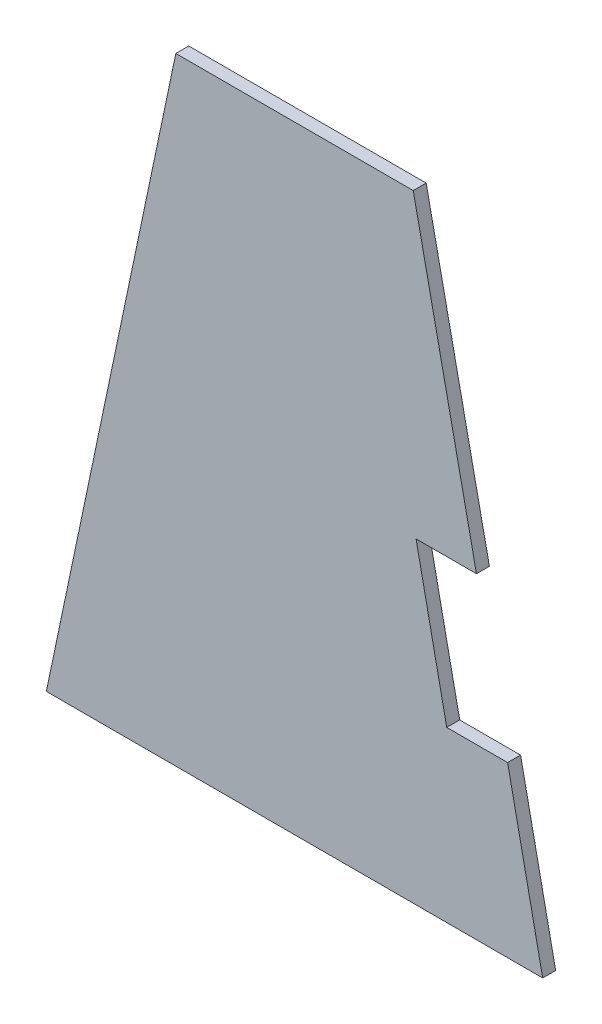
from build123d import *

# Parameters (mm, degrees)
BOSS_EXTRUDE1_DEPTH = 3


with BuildPart() as part:
    # Sketch1 → Boss-Extrude1 (new body)
    with BuildSketch(Plane.XY):
        Polygon((0, 0), (115, 0), (106.871071862, 39.165297488), (92.765549088, 39.165297488), (85.652736968, 73.43493279), (99.652736968, 73.43493279), (85, 143), (30, 143), align=None)
    extrude(amount=BOSS_EXTRUDE1_DEPTH)


solid = part.part
